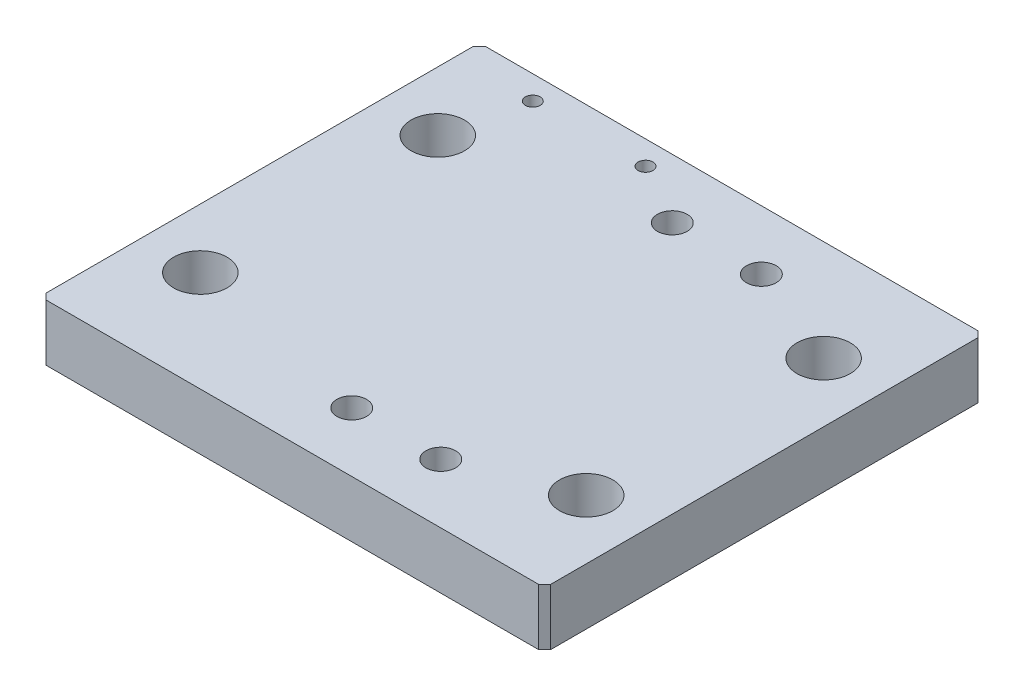
from build123d import *

# Parameters (mm, degrees)
SKETCH1_W             = 85
SKETCH1_H             = 74
BOSS_EXTRUDE1_DEPTH   = 9.525
M8_CLEARANCE_HOLE1_D  = 9
M6X1_0_TAPPED_HOLE1_D = 5
M3X0_5_TAPPED_HOLE1_D = 2.5
CHAMFER1_SIZE         = 1


with BuildPart() as part:
    # Sketch1 → Boss-Extrude1 (new body)
    with BuildSketch(Plane(origin=(0, 0, 0), x_dir=(1, 0, 0), z_dir=(0, 1, 0))):
        Rectangle(SKETCH1_W, SKETCH1_H)
    extrude(amount=BOSS_EXTRUDE1_DEPTH)

    # M8 Clearance Hole1 (through all)
    with Locations(Plane(origin=(0, 9.525, 0), x_dir=(1, 0, 0), z_dir=(0, 1, 0))):
        with Locations((-32.5, 20), (32.5, 20), (32.5, -20), (-32.5, -20)):
            Hole(M8_CLEARANCE_HOLE1_D / 2)

    # M6x1.0 Tapped Hole1 (through all)
    with Locations(Plane(origin=(0, 9.525, 0), x_dir=(1, 0, 0), z_dir=(0, 1, 0))):
        with Locations((0, 27), (15, 27), (15, -27), (0, -27)):
            Hole(M6X1_0_TAPPED_HOLE1_D / 2)

    # M3x0.5 Tapped Hole1 (through all)
    with Locations(Plane(origin=(0, 9.525, 0), x_dir=(1, 0, 0), z_dir=(0, 1, 0))):
        with Locations((-29.5, 33), (-10.5, 33)):
            Hole(M3X0_5_TAPPED_HOLE1_D / 2)

    # Chamfer1
    chamfer1_edges = [part.edges().sort_by_distance(p)[0] for p in [
        (42.5, 4.7625, 37),
        (-42.5, 4.7625, 37),
        (-42.5, 4.7625, -37),
        (42.5, 4.7625, -37),
    ]]
    chamfer(chamfer1_edges, length=CHAMFER1_SIZE)


solid = part.part
